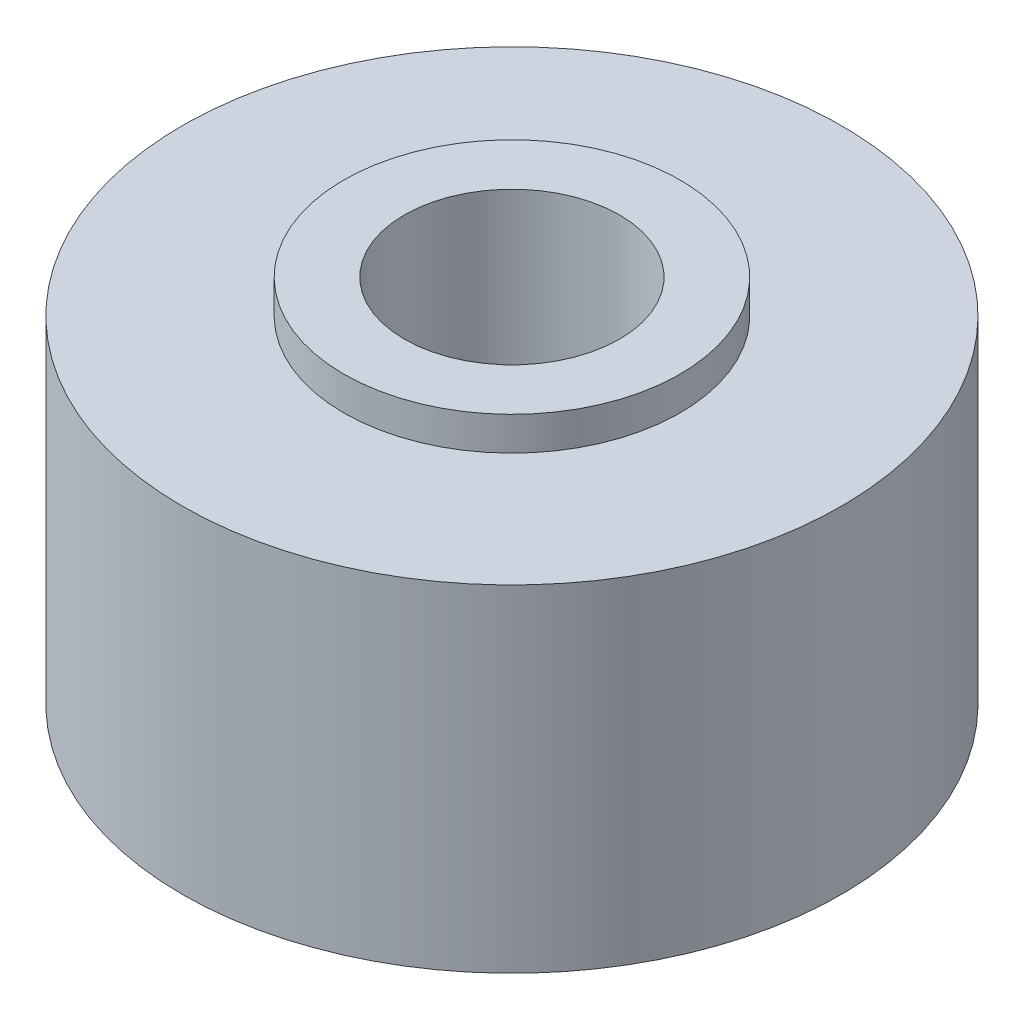
from build123d import *

# Parameters (mm, degrees)
SKETCH1_R           = 4.9
SKETCH1_R_2         = 1.6
BOSS_EXTRUDE1_DEPTH = 5
SKETCH2_R           = 2.5
SKETCH2_R_2         = 1.6
BOSS_EXTRUDE2_DEPTH = 0.5


with BuildPart() as part:
    # Sketch1 → Boss-Extrude1 (new body)
    with BuildSketch(Plane(origin=(0, 0, 0), x_dir=(1, 0, 0), z_dir=(0, 1, 0))):
        with Locations(Location((0, 0, 0), (0, 0, 270))):
            Circle(SKETCH1_R)
        with Locations(Location((0, 0, 0), (0, 0, 270))):
            Circle(SKETCH1_R_2, mode=Mode.SUBTRACT)
    extrude(amount=BOSS_EXTRUDE1_DEPTH)

    # Sketch2 → Boss-Extrude2 (add)
    with BuildSketch(Plane(origin=(0, 5, 0), x_dir=(1, 0, 0), z_dir=(0, 1, 0))):
        with Locations(Location((0, 0, 0), (0, 0, 270))):
            Circle(SKETCH2_R)
        with Locations(Location((0, 0, 0), (0, 0, 270))):
            Circle(SKETCH2_R_2, mode=Mode.SUBTRACT)
    extrude(amount=BOSS_EXTRUDE2_DEPTH)


solid = part.part
